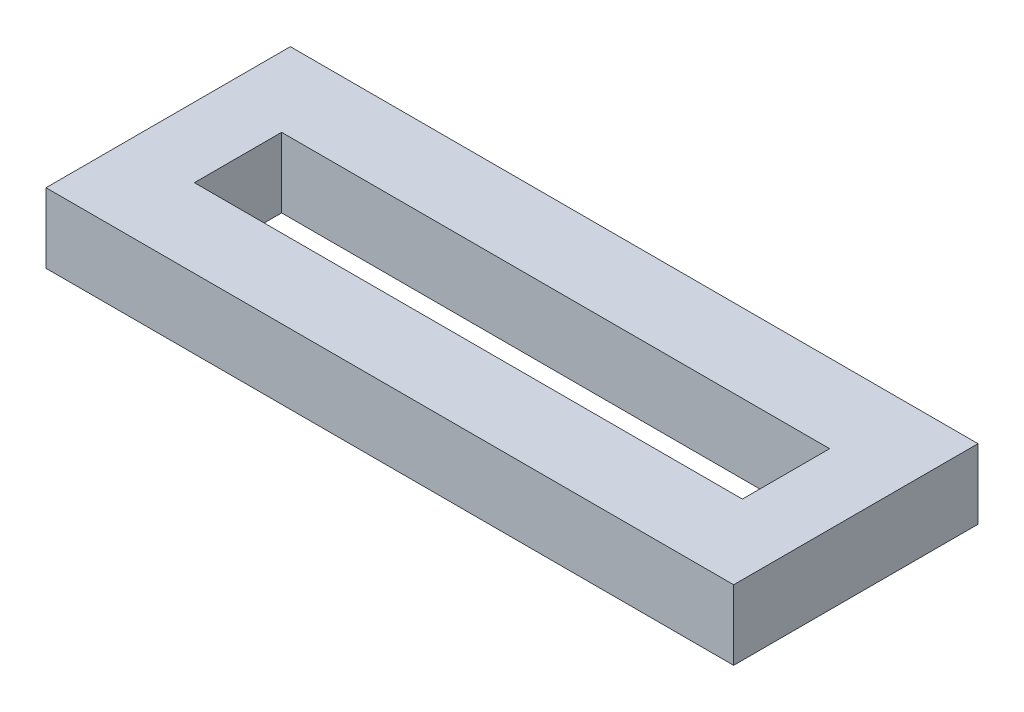
from build123d import *

# Parameters (mm, degrees)
CROQUIS1_W              = 39.4
CROQUIS1_H              = 14
CROQUIS1_W_2            = 31.4
CROQUIS1_H_2            = 5
SALIENTE_EXTRUIR1_DEPTH = 4


with BuildPart() as part:
    # Croquis1 → Saliente-Extruir1 (new body)
    with BuildSketch(Plane(origin=(0, 0, 0), x_dir=(1, 0, 0), z_dir=(0, 1, 0))):
        with Locations((-19.7, -7)):
            Rectangle(CROQUIS1_W, CROQUIS1_H)
        with Locations((-19.7, -7)):
            Rectangle(CROQUIS1_W_2, CROQUIS1_H_2, mode=Mode.SUBTRACT)
    extrude(amount=SALIENTE_EXTRUIR1_DEPTH)


solid = part.part
